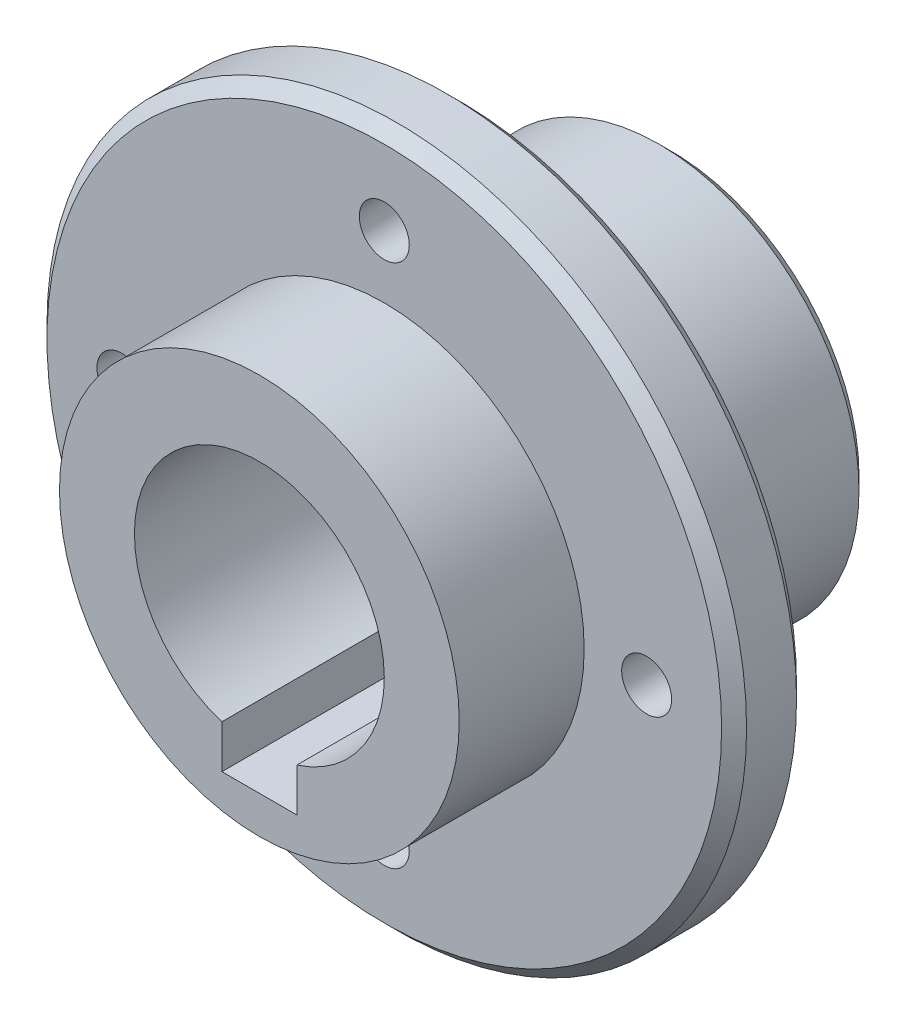
from build123d import *

# Parameters (mm, degrees)
SKETCH_1_R               = 16
EXTRUDE_1_DEPTH          = 13
SKETCH_2_R               = 16
EXTRUDE_2_DEPTH          = 4
SKETCH_3_R               = 28
EXTRUDE_3_DEPTH          = 6
SKETCH_4_R               = 7
EXTRUDE_4_DEPTH          = 5
SKETCH_6_R               = 2
CUT_EXTRUDE_1_DEPTH      = 10
SKETCH_7_R               = 10
CUT_EXTRUDE_2_DEPTH      = 60
PATTERN_CIRCULAR_2_COUNT = 4
CHAMFER_3_SIZE           = 1
CHAMFER_4_SIZE           = 1
CHAMFER_6_SIZE           = 1
SKETCH_8_R               = 16
SKETCH_8_R_2             = 10
EXTRUDE_5_DEPTH          = 10
CUT_EXTRUDE_3_DEPTH      = 13


with BuildPart() as part:
    # 草图1 → 凸台-拉伸1 (new body)
    with BuildSketch(Plane.XY):
        with Locations(Location((0, 0, 0), (0, 0, 180))):
            Circle(SKETCH_1_R)
    extrude(amount=EXTRUDE_1_DEPTH)

    # 草图2 → 凸台-拉伸2 (add)
    with BuildSketch(Plane.XY.offset(13)):
        with Locations(Location((0, 0, 0), (0, 0, 180))):
            Circle(SKETCH_2_R)
    extrude(amount=EXTRUDE_2_DEPTH)

    # 草图3 → 凸台-拉伸3 (add)
    with BuildSketch(Plane.XY.offset(17)):
        Circle(SKETCH_3_R)
    extrude(amount=EXTRUDE_3_DEPTH)

    # 草图4 → 凸台-拉伸4 (add)
    with BuildSketch(Plane.XY.offset(23)):
        Circle(SKETCH_4_R)
    extrude(amount=EXTRUDE_4_DEPTH)

    # 草图6 → 切除-拉伸1 (cut)
    with BuildSketch(Plane(origin=(0, 0, 17), x_dir=(-1, 0, 0), z_dir=(0, 0, -1))):
        with Locations((0, 21)):
            Circle(SKETCH_6_R)
    cut_extrude_1 = extrude(amount=-CUT_EXTRUDE_1_DEPTH, mode=Mode.SUBTRACT)

    # 草图7 → 切除-拉伸2 (cut)
    with BuildSketch(Plane(origin=(0, 0, 0), x_dir=(-1, 0, 0), z_dir=(0, 0, -1))):
        Circle(SKETCH_7_R)
    extrude(amount=-CUT_EXTRUDE_2_DEPTH, mode=Mode.SUBTRACT)

    # 阵列(圆周)2: 切除-拉伸1 ×4 about axis
    pattern_circular_2_axis = Axis((0, 0, 0), (0, 0, 1))
    for i in range(1, PATTERN_CIRCULAR_2_COUNT):
        add(cut_extrude_1.rotate(pattern_circular_2_axis, i * 360 / PATTERN_CIRCULAR_2_COUNT), mode=Mode.SUBTRACT)

    # 倒角3
    chamfer_3_edges = [part.edges().sort_by_distance(p)[0] for p in [
        (-28, 0, 23),
    ]]
    chamfer(chamfer_3_edges, length=CHAMFER_3_SIZE)

    # 倒角4
    chamfer_4_edges = [part.edges().sort_by_distance(p)[0] for p in [
        (-28, 0, 17),
    ]]
    chamfer(chamfer_4_edges, length=CHAMFER_4_SIZE)

    # 倒角6
    chamfer_6_edges = [part.edges().sort_by_distance(p)[0] for p in [
        (16, 0, 0),
    ]]
    chamfer(chamfer_6_edges, length=CHAMFER_6_SIZE)

    # 草图8 → 凸台-拉伸5 (add)
    with BuildSketch(Plane.XY.offset(23)):
        with Locations(Location((0, 0, 0), (0, 0, 180))):
            Circle(SKETCH_8_R)
        with Locations(Location((0, 0, 0), (0, 0, 180))):
            Circle(SKETCH_8_R_2, mode=Mode.SUBTRACT)
    extrude(amount=EXTRUDE_5_DEPTH)

    # 草图9 → 切除-拉伸3 (cut)
    with BuildSketch(Plane(origin=(0, 0, 0), x_dir=(1, 0, 0), z_dir=(0, 1, 0))):
        Polygon((-3, 0), (0, 0), (3, 0), (3, -33), (-3, -33), align=None)
    extrude(amount=-CUT_EXTRUDE_3_DEPTH, mode=Mode.SUBTRACT)


solid = part.part
